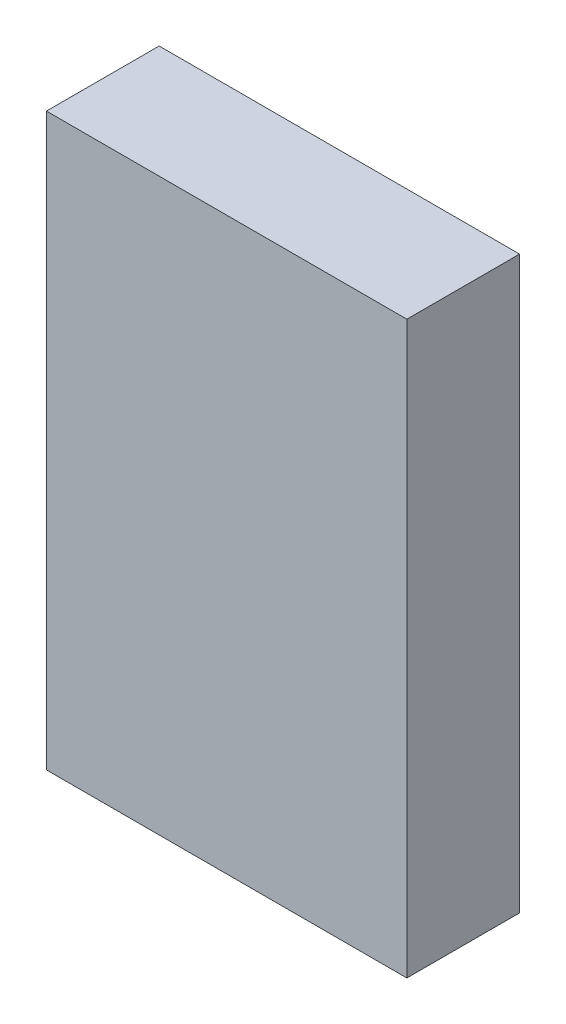
from build123d import *

# Parameters (mm, degrees)
SKETCH1_W           = 104.775
SKETCH1_H           = 165.862
BOSS_EXTRUDE1_DEPTH = 32.766
SKETCH2_W           = 101.6
SKETCH2_H           = 120.65
CUT_EXTRUDE1_DEPTH  = 25.4


with BuildPart() as part:
    # Sketch1 → Boss-Extrude1 (new body)
    with BuildSketch(Plane.XY):
        Rectangle(SKETCH1_W, SKETCH1_H)
    extrude(amount=-BOSS_EXTRUDE1_DEPTH)

    # Sketch2 → Cut-Extrude1 (cut)
    with BuildSketch(Plane(origin=(0, 0, -32.766), x_dir=(-1, 0, 0), z_dir=(0, 0, -1))):
        Rectangle(SKETCH2_W, SKETCH2_H)
    extrude(amount=-CUT_EXTRUDE1_DEPTH, mode=Mode.SUBTRACT)


solid = part.part
